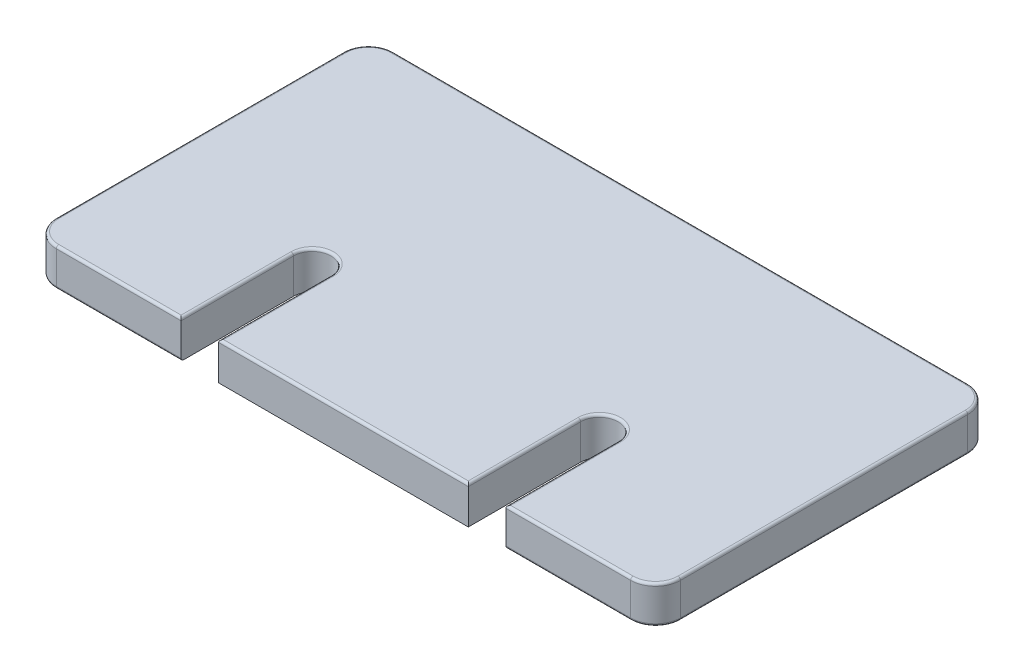
from build123d import *

# Parameters (mm, degrees)
BOSS_EXTRUDE1_DEPTH = 3
FILLET1_R           = 0.2


with BuildPart() as part:
    # Sketch1 → Boss-Extrude1 (new body)
    with BuildSketch(Plane(origin=(0, 0, 0), x_dir=(1, 0, 0), z_dir=(0, 1, 0))):
        with BuildLine():
            Line((10, 0), (-10, 0))
            Line((-10, 0), (-10, 9))
            ThreePointArc((-10, 9), (-11.5, 10.5), (-13, 9))
            Line((-13, 9), (-13, 0))
            Line((-13, 0), (-23, 0))
            ThreePointArc((-23, 0), (-24.414213562, 0.585786438), (-25, 2))
            Line((-25, 2), (-25, 25))
            ThreePointArc((-25, 25), (-24.414213562, 26.414213562), (-23, 27))
            Line((-23, 27), (23, 27))
            ThreePointArc((23, 27), (24.414213562, 26.414213562), (25, 25))
            Line((25, 25), (25, 2))
            ThreePointArc((25, 2), (24.414213562, 0.585786438), (23, 0))
            Line((23, 0), (13, 0))
            Line((13, 0), (13, 9))
            ThreePointArc((13, 9), (11.5, 10.5), (10, 9))
            Line((10, 9), (10, 0))
        make_face()
    extrude(amount=BOSS_EXTRUDE1_DEPTH)

    # Fillet1
    fillet1_edges = [part.edges().sort_by_distance(p)[0] for p in [
        (0, 3, 0),
        (10, 3, -4.5),
        (-18, 0, 0),
        (-24.414213562, 0, -0.585786438),
        (-25, 0, -13.5),
        (-24.414213562, 0, -26.414213562),
        (11.5, 3, -10.5),
        (0, 0, -27),
        (24.414213562, 0, -26.414213562),
        (25, 0, -13.5),
        (24.414213562, 0, -0.585786438),
        (18, 0, 0),
        (13, 3, -4.5),
        (18, 3, 0),
        (24.414213562, 3, -0.585786438),
        (25, 3, -13.5),
        (24.414213562, 3, -26.414213562),
        (0, 3, -27),
        (-24.414213562, 3, -26.414213562),
        (-11.5, 3, -10.5),
        (-25, 3, -13.5),
        (-24.414213562, 3, -0.585786438),
        (-18, 3, 0),
        (-13, 3, -4.5),
        (-10, 3, -4.5),
    ]]
    fillet(fillet1_edges, radius=FILLET1_R)


solid = part.part
